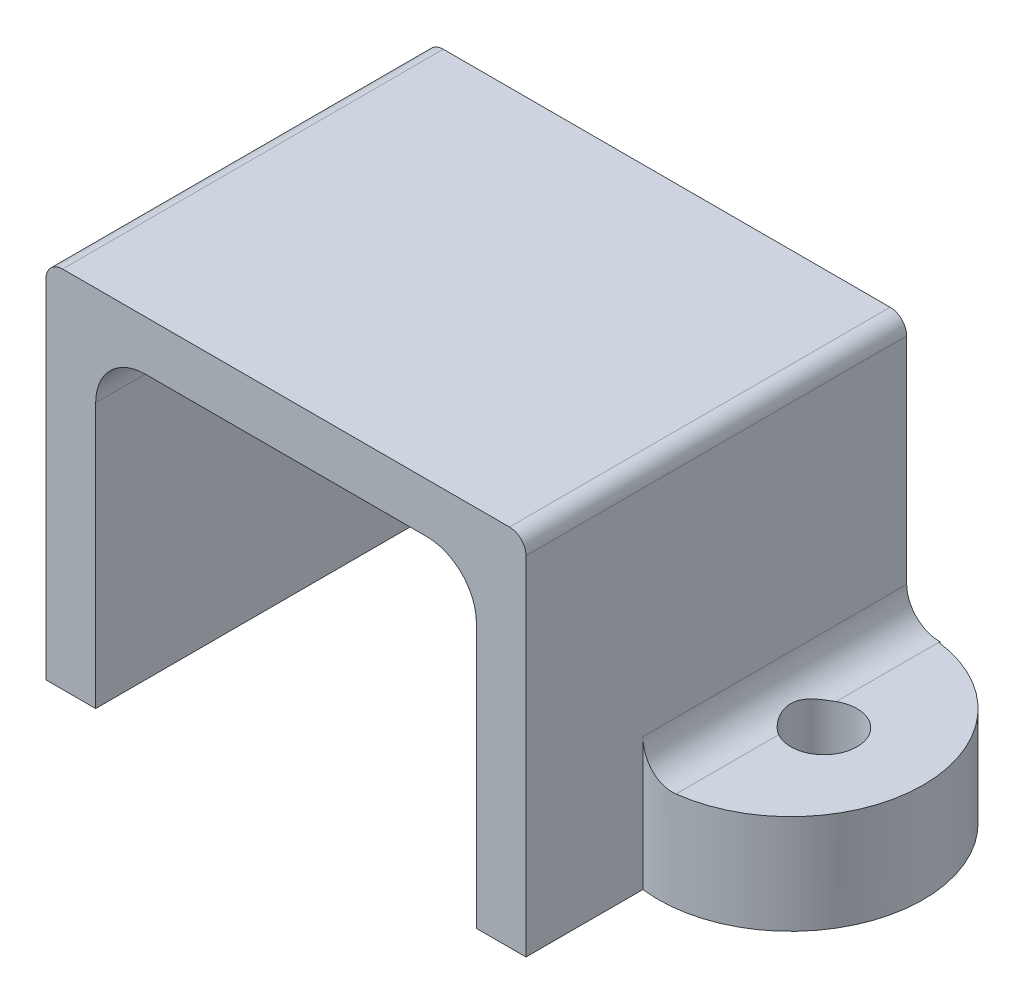
from build123d import *

# Parameters (mm, degrees)
SALIENTE_EXTRUIR1_DEPTH    = 11.5
REDONDEO1_R                = 0.5
CORTAR_EXTRUIR1_DEPTH      = 19.284214503
CORTAR_EXTRUIR2_DEPTH      = 19.284214567
CORTAR_EXTRUIR2_DEPTH_BACK = 19.284214567
CROQUIS4_R                 = 1


with BuildPart() as part:
    # Croquis1 → Saliente-Extruir1 (new body)
    with BuildSketch(Plane.XY):
        with BuildLine():
            Line((7.25, 0), (0, 0))
            Line((0, 0), (0, -1.5))
            Line((0, -1.5), (4.25, -1.5))
            ThreePointArc((4.25, -1.5), (5.310660172, -1.939339828), (5.75, -3))
            Line((5.75, -3), (5.75, -11))
            Line((5.75, -11), (11.75, -11))
            Line((11.75, -11), (11.75, -8))
            Line((11.75, -8), (8.25, -8))
            ThreePointArc((8.25, -8), (7.542893219, -7.707106781), (7.25, -7))
            Line((7.25, -7), (7.25, 0))
        make_face()
    saliente_extruir1 = extrude(amount=SALIENTE_EXTRUIR1_DEPTH)

    # Simetría1: Saliente-Extruir1 across plane
    add(saliente_extruir1.mirror(Plane(origin=(0, 0, 11.5), x_dir=(0, 0, 1), z_dir=(1, 0, 0))))

    # Redondeo1
    redondeo1_edges = [part.edges().sort_by_distance(p)[0] for p in [
        (7.25, 0, 5.75),
        (-7.25, 0, 5.75),
    ]]
    fillet(redondeo1_edges, radius=REDONDEO1_R)

    # Croquis3 → Cortar-Extruir1 (cut, symmetric)
    with BuildSketch(Plane(origin=(0, -8, 0), x_dir=(1, 0, 0), z_dir=(0, 1, 0))):
        with BuildLine():
            Line((8.25, -11.5), (8.25, -7.968626967))
            ThreePointArc((8.25, -7.968626967), (7.75, -8), (7.25, -7.968626967))
            Line((7.25, -7.968626967), (7.25, -11.5))
            Line((7.25, -11.5), (8.25, -11.5))
        make_face()
        with BuildLine():
            Line((11.75, -11.5), (11.75, -4))
            ThreePointArc((11.75, -4), (10.75, -6.645751311), (8.25, -7.968626967))
            Line((8.25, -7.968626967), (8.25, -11.5))
            Line((8.25, -11.5), (11.75, -11.5))
        make_face()
        with BuildLine():
            Line((11.75, 0), (8.25, 0))
            Line((8.25, 0), (8.25, -0.031373033))
            ThreePointArc((8.25, -0.031373033), (10.75, -1.354248689), (11.75, -4))
            Line((11.75, -4), (11.75, 0))
        make_face()
    cortar_extruir1 = extrude(amount=CORTAR_EXTRUIR1_DEPTH, both=True, mode=Mode.SUBTRACT)

    # Simetría2: Cortar-Extruir1 across plane
    add(cortar_extruir1.mirror(Plane(origin=(0, 0, 0), x_dir=(0, 0, 1), z_dir=(1, 0, 0))), mode=Mode.SUBTRACT)

    # Croquis4 → Cortar-Extruir2 (cut, two sides: drawn at the far end of the back side and taken through both)
    with BuildSketch(Plane(origin=(0, -8, 0), x_dir=(1, 0, 0), z_dir=(0, 1, 0)).offset(-CORTAR_EXTRUIR2_DEPTH_BACK)):
        with Locations(Location((8.75, -4, 0), (0, 0, 180))):
            Circle(CROQUIS4_R)
        with Locations(Location((-8.75, -4, 0), (0, 0, 60))):
            Circle(CROQUIS4_R)
    extrude(amount=CORTAR_EXTRUIR2_DEPTH + CORTAR_EXTRUIR2_DEPTH_BACK, mode=Mode.SUBTRACT)


solid = part.part
